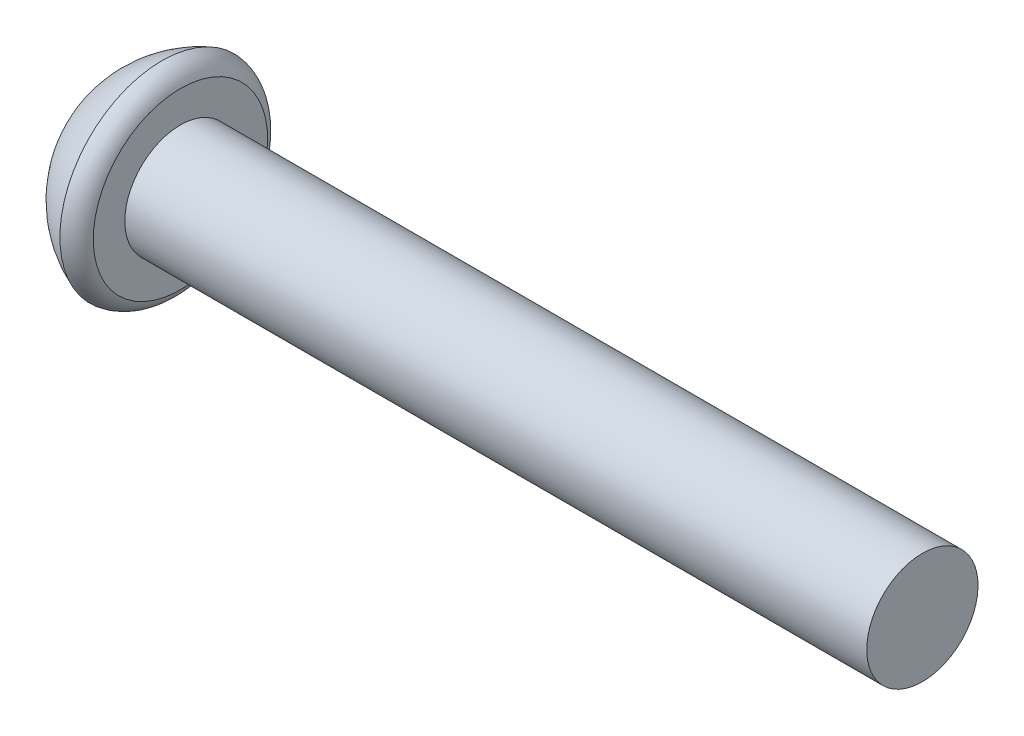
from build123d import *

# Parameters (mm, degrees)
CUT_EXTRUDE1_DEPTH = 1.5


with BuildPart() as part:
    # Sketch1 → Revolve1 (revolve)
    with BuildSketch(Plane.XY):
        with BuildLine():
            Line((0, 0), (20, 0))
            Line((20, 0), (20, -1.5))
            Line((20, -1.5), (-2, -1.5))
            Line((-2, -1.5), (-2, 0))
            ThreePointArc((-2, 0), (-1.356037029, 0.752244435), (-0.5, 1.25))
            ThreePointArc((-0.5, 1.25), (-0.192181086, 1.122273642), (0, 0.85))
            Line((0, 0.85), (0, 0))
        make_face()
    revolve(axis=Axis((20, -1.5, 0), (-1, 0, 0)))

    # Sketch2 → Cut-Extrude1 (cut)
    with BuildSketch(Plane.ZY.offset(2)):
        Polygon((0, -0.229829408), (-1.1, -0.864914704), (-1.1, -2.135085296), (0, -2.770170592), (1.1, -2.135085296), (1.1, -0.864914704), align=None)
    extrude(amount=-CUT_EXTRUDE1_DEPTH, mode=Mode.SUBTRACT)


solid = part.part
